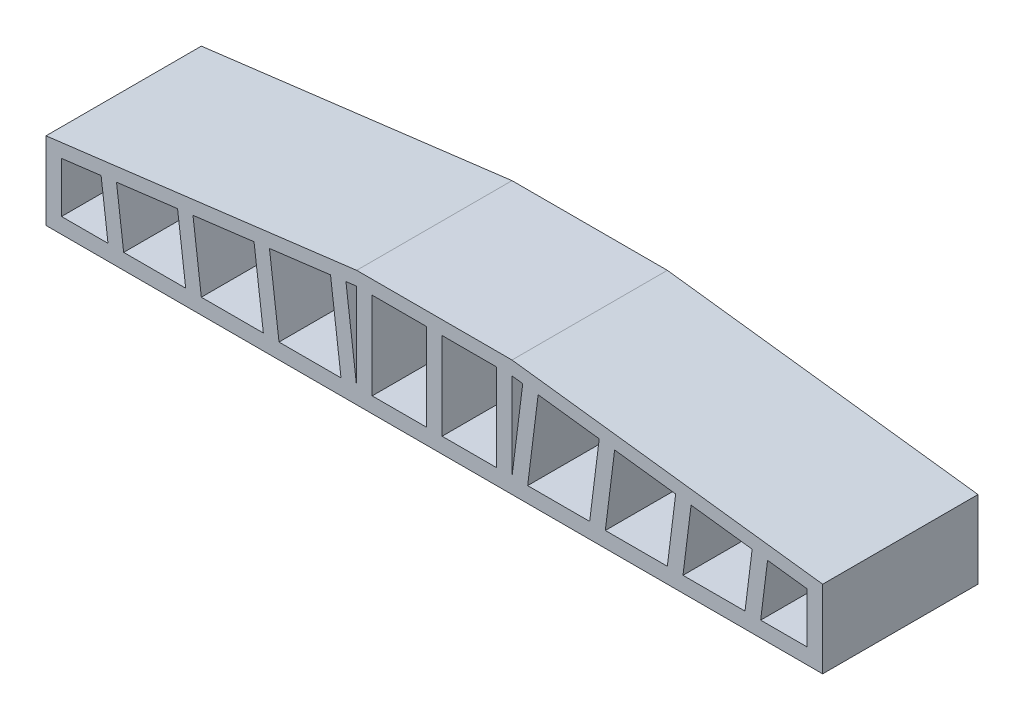
from build123d import *

# Parameters (mm, degrees)
SKETCH1_W           = 7
SKETCH1_H           = 11.231344736
BOSS_EXTRUDE1_DEPTH = 20


with BuildPart() as part:
    # Sketch1 → Boss-Extrude1 (new body)
    with BuildSketch(Plane.XY):
        Polygon((50, 0), (50, 10), (36.215384615, 11.723076923), (31.292307692, 12.338461538), (26.369230769, 12.953846154), (10, 15), (-10, 15), (-50, 10), (-50, 0), align=None)
        Polygon((-42.015564437, 2), (-48, 2), (-48, 8.481344736), (-42.905336644, 9.118177656), align=None, mode=Mode.SUBTRACT)
        Polygon((-40.920780891, 9.366247125), (-33.059182798, 10.348946887), (-32.015564437, 2), (-40, 2), align=None, mode=Mode.SUBTRACT)
        Polygon((-31.074627044, 10.597016356), (-23.213028952, 11.579716117), (-22.015564437, 2), (-30, 2), align=None, mode=Mode.SUBTRACT)
        Polygon((-21.228473198, 11.827785587), (-13.366875106, 12.810485348), (-12.015564437, 2), (-20, 2), align=None, mode=Mode.SUBTRACT)
        Polygon((15, 2), (12.015564437, 2), (13.366875106, 12.810485348), (16.305396275, 12.443170202), (18.289952029, 12.195100733), (21.228473198, 11.827785587), (20, 2), (17.015564437, 2), align=None, mode=Mode.SUBTRACT)
        Polygon((47.828413567, 8.502793041), (48, 8.481344736), (48, 2), (47.015564437, 2), (45, 2), (42.015564437, 2), (42.905336644, 9.118177656), (45.843857814, 8.75086251), align=None, mode=Mode.SUBTRACT)
        Polygon((37.015564437, 2), (32.015564437, 2), (33.059182798, 10.348946887), (37.982259721, 9.733562271), (40.920780891, 9.366247125), (40, 2), align=None, mode=Mode.SUBTRACT)
        Polygon((27.015564437, 2), (22.015564437, 2), (23.213028952, 11.579716117), (28.136105875, 10.964331502), (31.074627044, 10.597016356), (30, 2), align=None, mode=Mode.SUBTRACT)
        Polygon((-10, 2), (-11.382319352, 13.058554817), (-10, 13.231344736), align=None, mode=Mode.SUBTRACT)
        with Locations((-4.5, 7.615672368)):
            Rectangle(SKETCH1_W, SKETCH1_H, mode=Mode.SUBTRACT)
        with Locations((4.5, 7.615672368)):
            Rectangle(SKETCH1_W, SKETCH1_H, mode=Mode.SUBTRACT)
        Polygon((10, 2), (10, 13.231344736), (11.382319352, 13.058554817), align=None, mode=Mode.SUBTRACT)
    extrude(amount=BOSS_EXTRUDE1_DEPTH)


solid = part.part
